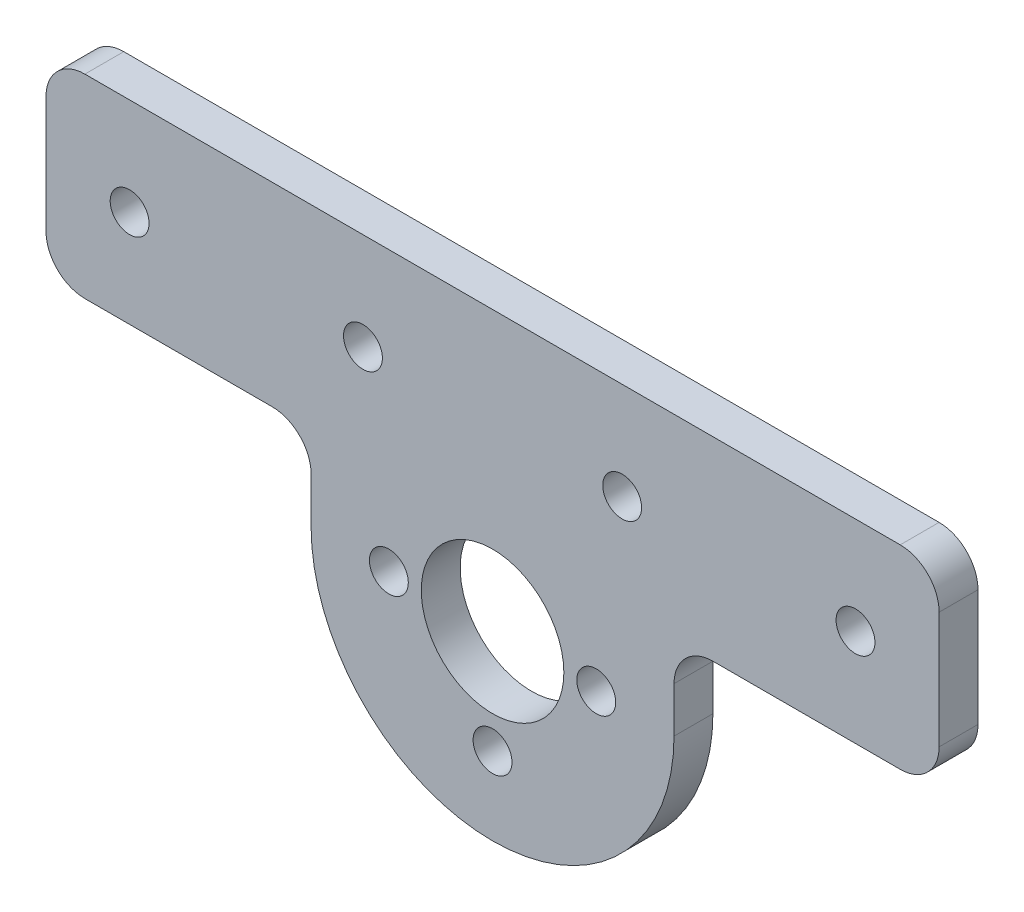
from build123d import *

# Parameters (mm, degrees)
SKETCH_1_R          = 14
SKETCH_1_R_2        = 1.5
EXTRUDE_1_DEPTH     = 3
SKETCH_2_R          = 5.5
CUT_EXTRUDE_1_DEPTH = 11
CUT_EXTRUDE_2_DEPTH = 11
SKETCH_6_R          = 1.5
CUT_EXTRUDE_3_DEPTH = 11
SKETCH_4_R          = 1.5
EXTRUDE_2_DEPTH     = 3
FILLET_1_R          = 3


with BuildPart() as part:
    # 草图1 → 凸台-拉伸1 (new body)
    # profile 1 of 2: a face of its own
    with BuildSketch(Plane.XY):
        with BuildLine():
            Line((-14, 27.287521581), (-14, 0))
            ThreePointArc((-14, 0), (0, 14), (14, 0))
            Line((14, 0), (14, 27.287521581))
            Line((14, 27.287521581), (-14, 27.287521581))
        make_face()
    # profile 2 of 2: a face of its own
    with BuildSketch(Plane.XY):
        Circle(SKETCH_1_R)
        with Locations((0, -8)):
            Circle(SKETCH_1_R_2, mode=Mode.SUBTRACT)
        with Locations((8, 0)):
            Circle(SKETCH_1_R_2, mode=Mode.SUBTRACT)
        with Locations((-8, 0)):
            Circle(SKETCH_1_R_2, mode=Mode.SUBTRACT)
    extrude(amount=EXTRUDE_1_DEPTH)

    # 草图2 → 切除-拉伸1 (cut)
    with BuildSketch(Plane.XY.offset(3)):
        Circle(SKETCH_2_R)
    extrude(amount=-CUT_EXTRUDE_1_DEPTH, mode=Mode.SUBTRACT)

    # 草图3 → 切除-拉伸2 (cut)
    with BuildSketch(Plane.XY.offset(3)):
        Polygon((14, 27.287521581), (22.040424941, 27.287521581), (22.040424941, 21.507521581), (-23.523215241, 21.507521581), (-23.523215241, 27.287521581), align=None)
    extrude(amount=-CUT_EXTRUDE_2_DEPTH, mode=Mode.SUBTRACT)

    # 草图6 → 切除-拉伸3 (cut)
    with BuildSketch(Plane.XY.offset(3)):
        with Locations((10, 14.007521581)):
            Circle(SKETCH_6_R)
        with Locations((-10, 14.007521581)):
            Circle(SKETCH_6_R)
    extrude(amount=-CUT_EXTRUDE_3_DEPTH, mode=Mode.SUBTRACT)

    # 草图4 → 凸台-拉伸2 (add)
    with BuildSketch(Plane.XY.offset(3)):
        Polygon((14, 21.507521581), (34.450975214, 21.507521581), (34.450975214, 6.507521581), (14, 6.507521581), (-14, 6.507521581), (-34.450975214, 6.507521581), (-34.450975214, 21.507521581), (-14, 21.507521581), align=None)
        with Locations((10, 14.007521581)):
            Circle(SKETCH_4_R, mode=Mode.SUBTRACT)
        with Locations((28, 14.007521581)):
            Circle(SKETCH_4_R, mode=Mode.SUBTRACT)
        with Locations((-10, 14.007521581)):
            Circle(SKETCH_4_R, mode=Mode.SUBTRACT)
        with Locations(Location((-28, 14.007521581, 0), (0, 0, 180))):
            Circle(SKETCH_4_R, mode=Mode.SUBTRACT)
    extrude(amount=-EXTRUDE_2_DEPTH)

    # 圆角1
    fillet_1_edges = [part.edges().sort_by_distance(p)[0] for p in [
        (-34.450975214, 21.507521581, 1.5),
        (-14, 6.507521581, 1.5),
        (34.450975214, 21.507521581, 1.5),
        (14, 6.507521581, 1.5),
        (34.450975214, 6.507521581, 1.5),
        (-34.450975214, 6.507521581, 1.5),
    ]]
    fillet(fillet_1_edges, radius=FILLET_1_R)


solid = part.part
